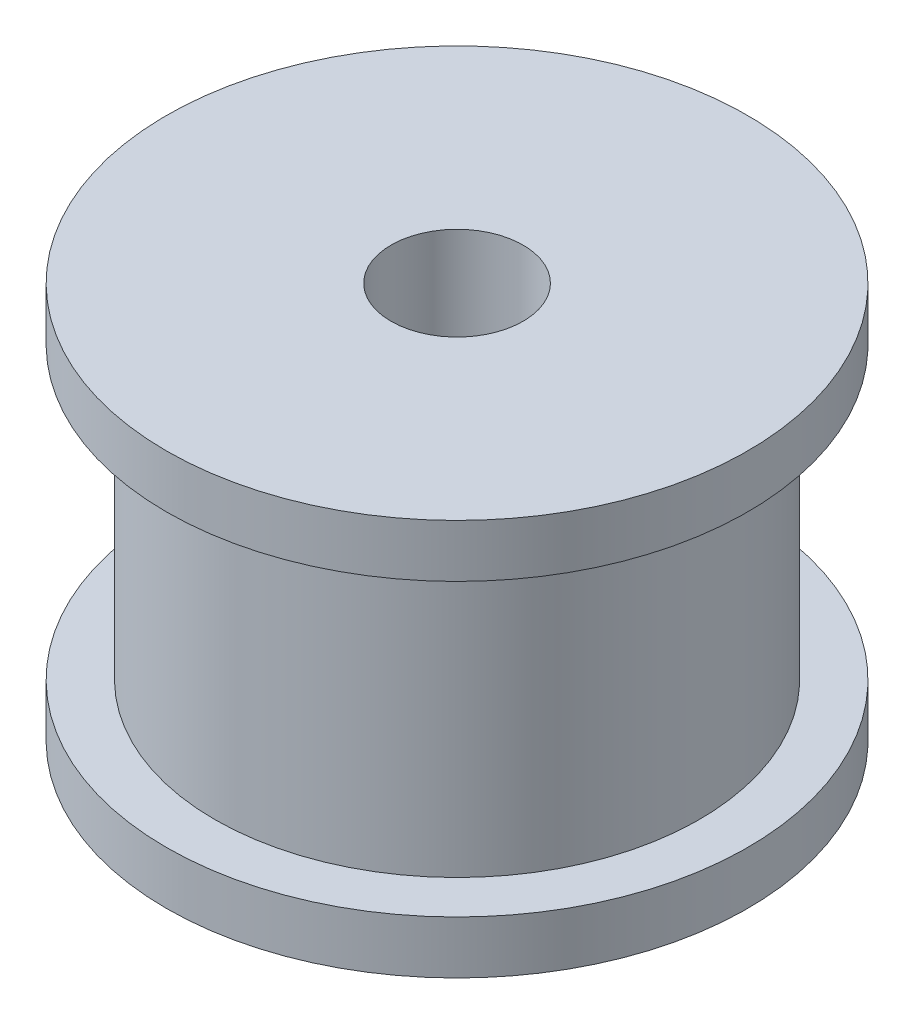
from build123d import *

# Parameters (mm, degrees)
SKETCH_1_R          = 11
EXTRUDE_1_DEPTH     = 2
SKETCH_2_R          = 9.17
EXTRUDE_2_DEPTH     = 11
SKETCH_3_R          = 11
EXTRUDE_3_DEPTH     = 2
SKETCH_4_R          = 2.5
CUT_EXTRUDE_1_DEPTH = 26


with BuildPart() as part:
    # 草图1 → 凸台-拉伸1 (new body)
    with BuildSketch(Plane(origin=(0, 0, 0), x_dir=(1, 0, 0), z_dir=(0, 1, 0))):
        with Locations(Location((0, 0, 0), (0, 0, 270))):
            Circle(SKETCH_1_R)
    extrude(amount=EXTRUDE_1_DEPTH)

    # 草图2 → 凸台-拉伸2 (add)
    with BuildSketch(Plane(origin=(0, 2, 0), x_dir=(1, 0, 0), z_dir=(0, 1, 0))):
        with Locations(Location((0, 0, 0), (0, 0, 270))):
            Circle(SKETCH_2_R)
    extrude(amount=EXTRUDE_2_DEPTH)

    # 草图3 → 凸台-拉伸3 (add)
    with BuildSketch(Plane(origin=(0, 13, 0), x_dir=(1, 0, 0), z_dir=(0, 1, 0))):
        with Locations(Location((0, 0, 0), (0, 0, 270))):
            Circle(SKETCH_3_R)
    extrude(amount=EXTRUDE_3_DEPTH)

    # 草图4 → 切除-拉伸1 (cut)
    with BuildSketch(Plane(origin=(0, 15, 0), x_dir=(1, 0, 0), z_dir=(0, 1, 0))):
        with Locations(Location((0, 0, 0), (0, 0, 270))):
            Circle(SKETCH_4_R)
    extrude(amount=-CUT_EXTRUDE_1_DEPTH, mode=Mode.SUBTRACT)


solid = part.part
